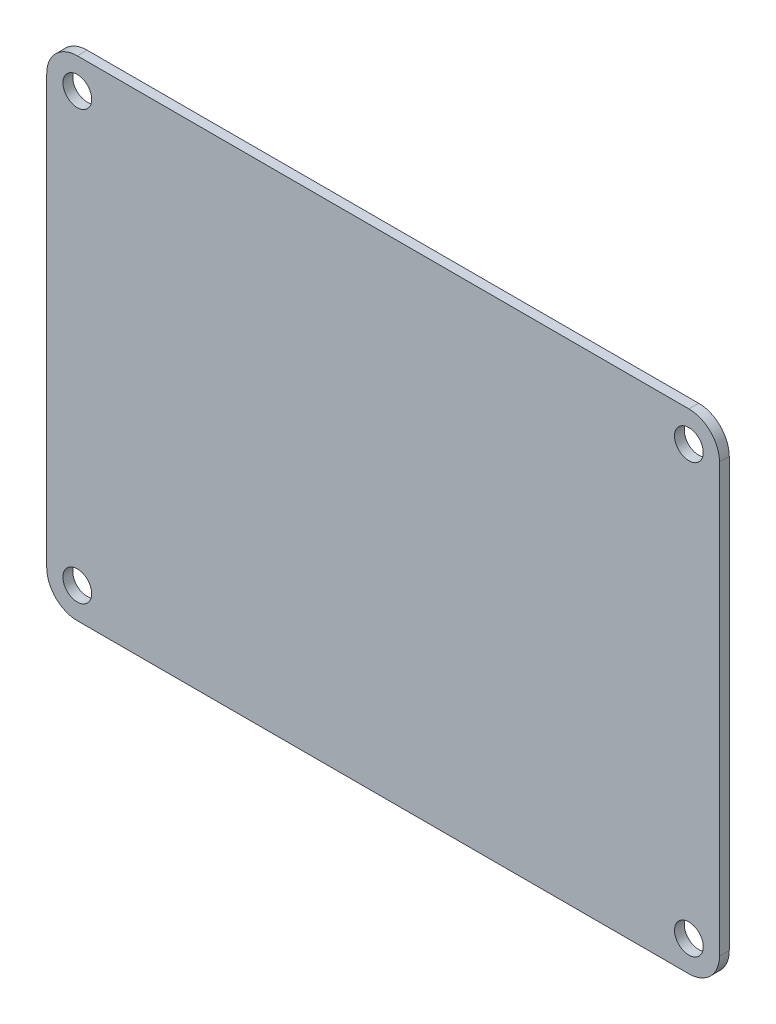
from build123d import *

# Parameters (mm, degrees)
SKETCH1_W           = 110
SKETCH1_H           = 80
SKETCH1_R           = 2.35
BOSS_EXTRUDE1_DEPTH = 1.6
FILLET1_R           = 5


with BuildPart() as part:
    # Sketch1 → Boss-Extrude1 (new body)
    with BuildSketch(Plane.XY):
        Rectangle(SKETCH1_W, SKETCH1_H)
        with Locations((50, 35)):
            Circle(SKETCH1_R, mode=Mode.SUBTRACT)
        with Locations((-50, 35)):
            Circle(SKETCH1_R, mode=Mode.SUBTRACT)
        with Locations((-50, -35)):
            Circle(SKETCH1_R, mode=Mode.SUBTRACT)
        with Locations((50, -35)):
            Circle(SKETCH1_R, mode=Mode.SUBTRACT)
    extrude(amount=BOSS_EXTRUDE1_DEPTH)

    # Fillet1
    fillet1_edges = [part.edges().sort_by_distance(p)[0] for p in [
        (55, -40, 0.8),
        (-55, -40, 0.8),
        (-55, 40, 0.8),
        (55, 40, 0.8),
    ]]
    fillet(fillet1_edges, radius=FILLET1_R)


solid = part.part
